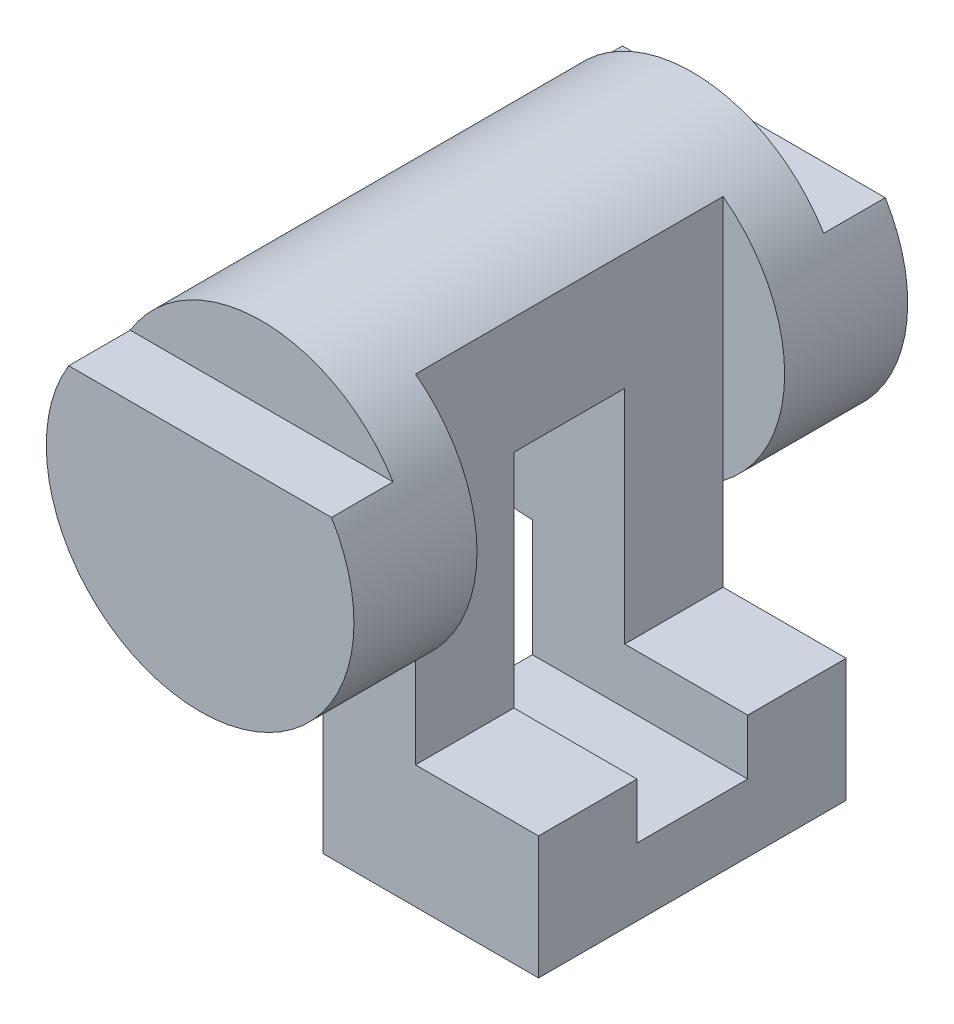
from build123d import *

# Parameters (mm, degrees)
SALIENTE_EXTRUIR1_DEPTH = 25
CROQUIS2_R              = 25
SALIENTE_EXTRUIR2_DEPTH = 45
CROQUIS3_W              = 18
CROQUIS3_H              = 45
CROQUIS3_W_2            = 10
CROQUIS3_H_2            = 12
CORTAR_EXTRUIR1_DEPTH   = 97.046863561
CROQUIS6_W              = 10
CROQUIS6_H              = 50
CORTAR_EXTRUIR2_DEPTH   = 86


with BuildPart() as part:
    # Croquis1 → Saliente-Extruir1 (new, symmetric)
    with BuildSketch(Plane.XY):
        with BuildLine():
            Line((-15, 10), (-15, -20))
            Line((-15, -20), (20, -20))
            Line((20, -20), (20, 0))
            Line((20, 0), (0, 0))
            Line((0, 0), (0, 15))
            ThreePointArc((0, 15), (-22.90569415, 58.717082451), (-15, 10))
        make_face()
    extrude(amount=SALIENTE_EXTRUIR1_DEPTH, both=True)

    # Croquis2 → Saliente-Extruir2 (add, symmetric)
    with BuildSketch(Plane.XY):
        with Locations((-15, 35)):
            Circle(CROQUIS2_R)
    extrude(amount=SALIENTE_EXTRUIR2_DEPTH, both=True)

    # Croquis3 → Cortar-Extruir1 (cut, through all)
    with BuildSketch(Plane(origin=(20, 0, 0), x_dir=(0, 0, -1), z_dir=(1, 0, 0))):
        with Locations((0, 13.5)):
            Rectangle(CROQUIS3_W, CROQUIS3_H)
        with Locations((-40, 54)):
            Rectangle(CROQUIS3_W_2, CROQUIS3_H_2)
        with Locations((40, 54)):
            Rectangle(CROQUIS3_W_2, CROQUIS3_H_2)
    extrude(amount=-CORTAR_EXTRUIR1_DEPTH, mode=Mode.SUBTRACT)

    # Croquis6 → Cortar-Extruir2 (cut, through all)
    with BuildSketch(Plane(origin=(0, 0, 0), x_dir=(1, 0, 0), z_dir=(0, 1, 0))):
        with Locations((5, 0)):
            Rectangle(CROQUIS6_W, CROQUIS6_H)
    extrude(amount=CORTAR_EXTRUIR2_DEPTH, mode=Mode.SUBTRACT)


solid = part.part
